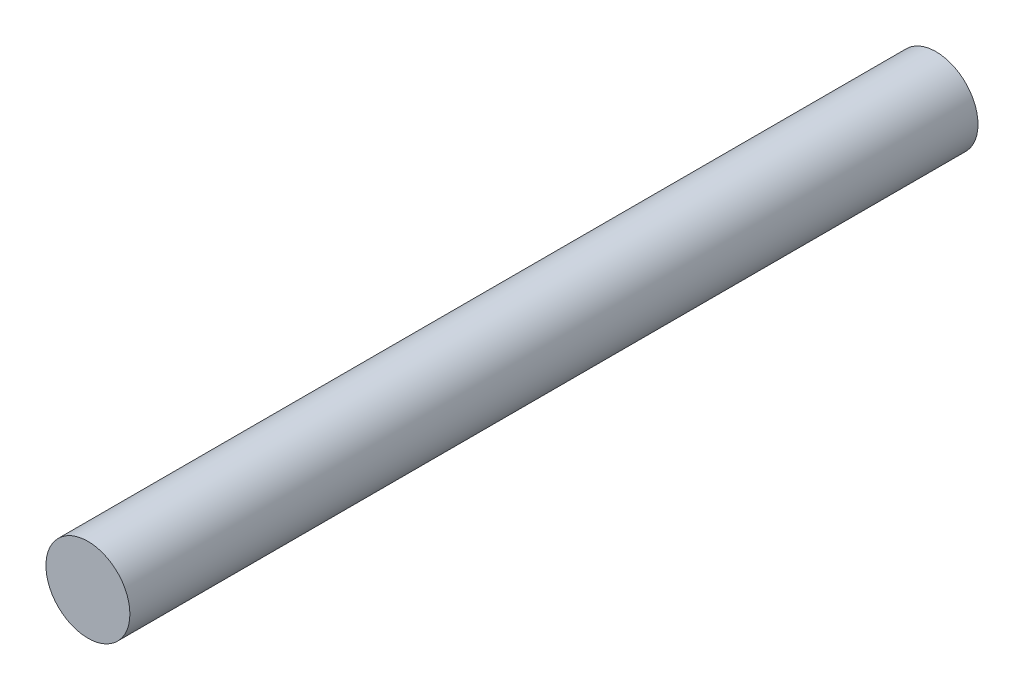
from build123d import *

# Parameters (mm, degrees)
SKETCH1_R           = 5
BOSS_EXTRUDE1_DEPTH = 101


with BuildPart() as part:
    # Sketch1 → Boss-Extrude1 (new body)
    with BuildSketch(Plane(origin=(0, 0, 0), x_dir=(0, 1, 0), z_dir=(0, 0, 1))):
        with Locations(Location((0, 0, 0), (0, 0, 270))):
            Circle(SKETCH1_R)
    extrude(amount=BOSS_EXTRUDE1_DEPTH)


solid = part.part
